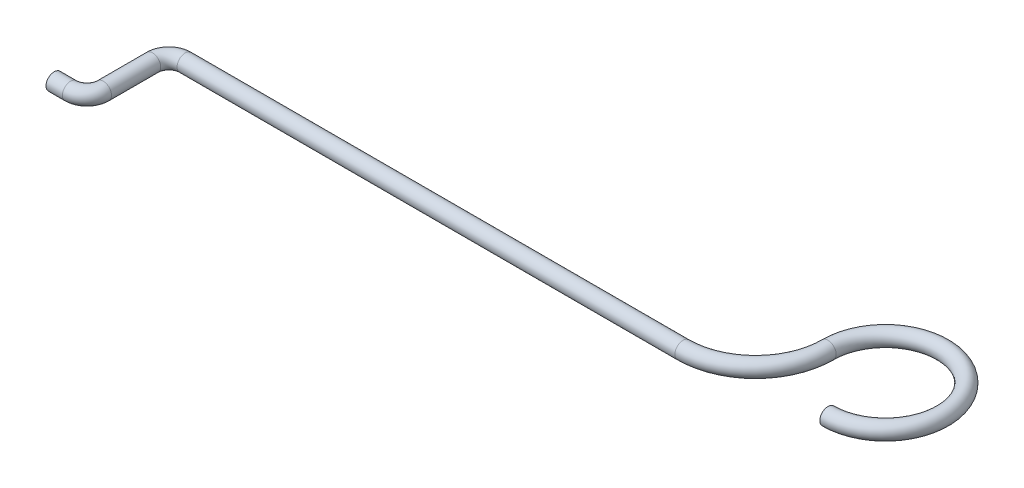
from build123d import *

# Parameters (mm, degrees)
SKETCH2_R = 0.5


with BuildPart() as part:
    # Sweep1: sweep along a path in Sketch1
    with BuildLine(Plane(origin=(0, 0, 0), x_dir=(1, 0, 0), z_dir=(0, 1, 0))) as sweep1_path:
        Line((0, 0), (1, 0))
        ThreePointArc((1, 0), (1.707106781, 0.292893219), (2, 1))
        Line((2, 1), (2, 4))
        ThreePointArc((2, 4), (2.292893219, 4.707106781), (3, 5))
        Line((3, 5), (33.38345031, 5))
        ThreePointArc((33.38345031, 5), (36.510288589, 6.295178823), (37.805467412, 9.422017102))
        ThreePointArc((37.805467412, 9.422017102), (43.780341146, 11.896890836), (41.305467412, 5.922017102))
    # Sketch2 → Sweep1 (sweep)
    with BuildSketch(Plane(origin=(0, 0, 0), x_dir=(0, 0, -1), z_dir=(1, 0, 0))):
        Circle(SKETCH2_R)
    sweep(path=sweep1_path.line)


solid = part.part
